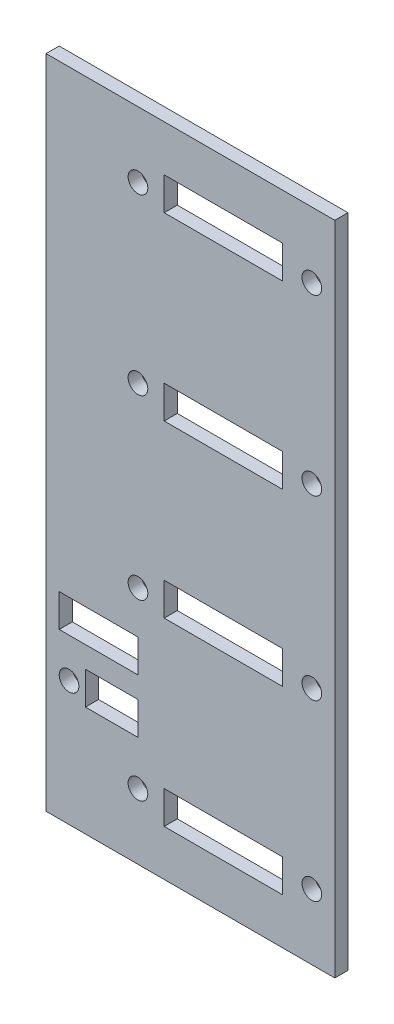
from build123d import *

# Parameters (mm, degrees)
SKETCH1_W           = 44
SKETCH1_H           = 100
BOSS_EXTRUDE1_DEPTH = 2
SKETCH2_R           = 1.5
CUT_EXTRUDE1_DEPTH  = 2
SKETCH3_W           = 18
SKETCH3_H           = 5
CUT_EXTRUDE2_DEPTH  = 10
SKETCH4_R           = 1.5
SKETCH4_W           = 12
SKETCH4_H           = 5
SKETCH4_W_2         = 8
CUT_EXTRUDE3_DEPTH  = 55.662601475


with BuildPart() as part:
    # Sketch1 → Boss-Extrude1 (new body)
    with BuildSketch(Plane.XY):
        Rectangle(SKETCH1_W, SKETCH1_H)
    extrude(amount=BOSS_EXTRUDE1_DEPTH)

    # Sketch2 → Cut-Extrude1 (cut)
    with BuildSketch(Plane.XY.offset(2)):
        with Locations((-8, -40)):
            Circle(SKETCH2_R)
        with Locations((18.5, -40)):
            Circle(SKETCH2_R)
        with Locations(Location((18.5, -13.5, 0), (0, 0, 180))):
            Circle(SKETCH2_R)
        with Locations(Location((-8, -13.5, 0), (0, 0, 180))):
            Circle(SKETCH2_R)
        with Locations(Location((18.5, 40, 0), (0, 0, 180))):
            Circle(SKETCH2_R)
        with Locations(Location((-8, 40, 0), (0, 0, 180))):
            Circle(SKETCH2_R)
        with Locations((18.5, 13.5)):
            Circle(SKETCH2_R)
        with Locations((-8, 13.5)):
            Circle(SKETCH2_R)
    extrude(amount=-CUT_EXTRUDE1_DEPTH, mode=Mode.SUBTRACT)

    # Sketch3 → Cut-Extrude2 (cut)
    with BuildSketch(Plane.XY.offset(2)):
        with Locations((5, 40.5)):
            Rectangle(SKETCH3_W, SKETCH3_H)
        with Locations((5, 13.004717401)):
            Rectangle(SKETCH3_W, SKETCH3_H)
        with Locations((5, -13.004717401)):
            Rectangle(SKETCH3_W, SKETCH3_H)
        with Locations((5, -40.5)):
            Rectangle(SKETCH3_W, SKETCH3_H)
    extrude(amount=-CUT_EXTRUDE2_DEPTH, mode=Mode.SUBTRACT)

    # Sketch4 → Cut-Extrude3 (cut, through all)
    with BuildSketch(Plane.XY.offset(2)):
        with Locations((-18.5, -31)):
            Circle(SKETCH4_R)
        with Locations((-14, -22.5)):
            Rectangle(SKETCH4_W, SKETCH4_H)
        with Locations((-12, -30.746090286)):
            Rectangle(SKETCH4_W_2, SKETCH4_H)
    extrude(amount=-CUT_EXTRUDE3_DEPTH, mode=Mode.SUBTRACT)


solid = part.part
